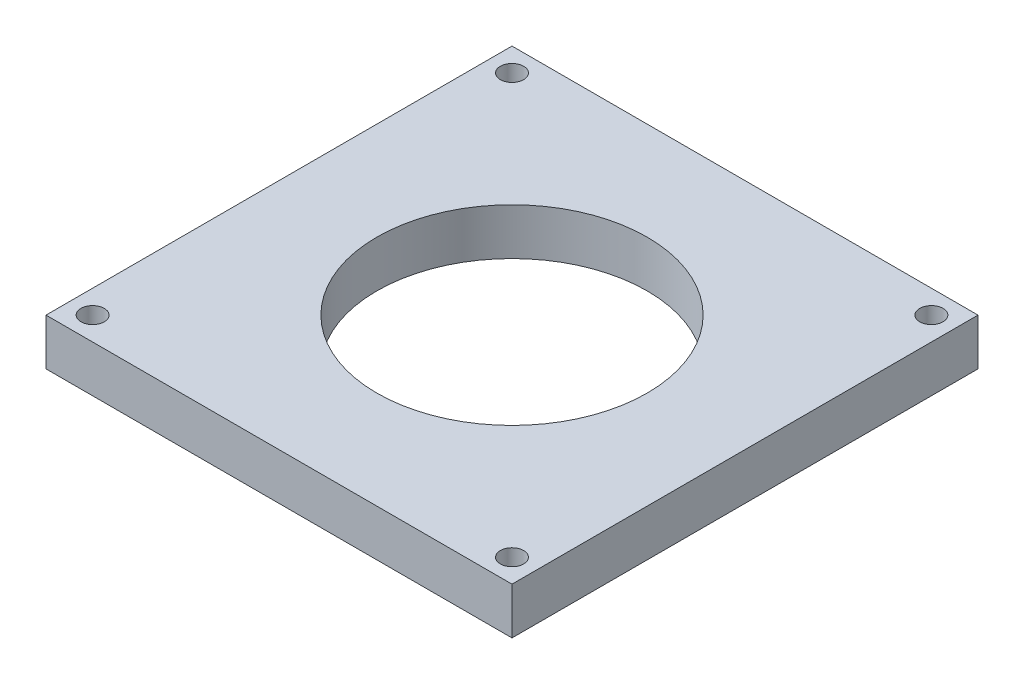
from build123d import *

# Parameters (mm, degrees)
SKETCH2_W           = 25.4
SKETCH2_H           = 25.4
SKETCH2_R           = 7.366
SKETCH2_R_2         = 0.635
BOSS_EXTRUDE3_DEPTH = 2.54


with BuildPart() as part:
    # Sketch2 → Boss-Extrude3 (new body)
    with BuildSketch(Plane(origin=(0, 0, 0), x_dir=(1, 0, 0), z_dir=(0, 1, 0))):
        Rectangle(SKETCH2_W, SKETCH2_H)
        with Locations(Location((0, 0, 0), (0, 0, 270))):
            Circle(SKETCH2_R, mode=Mode.SUBTRACT)
        with Locations(Location((11.43, 11.43, 0), (0, 0, 270))):
            Circle(SKETCH2_R_2, mode=Mode.SUBTRACT)
        with Locations(Location((11.43, -11.43, 0), (0, 0, 270))):
            Circle(SKETCH2_R_2, mode=Mode.SUBTRACT)
        with Locations(Location((-11.43, -11.43, 0), (0, 0, 270))):
            Circle(SKETCH2_R_2, mode=Mode.SUBTRACT)
        with Locations(Location((-11.43, 11.43, 0), (0, 0, 270))):
            Circle(SKETCH2_R_2, mode=Mode.SUBTRACT)
    extrude(amount=BOSS_EXTRUDE3_DEPTH)


solid = part.part
